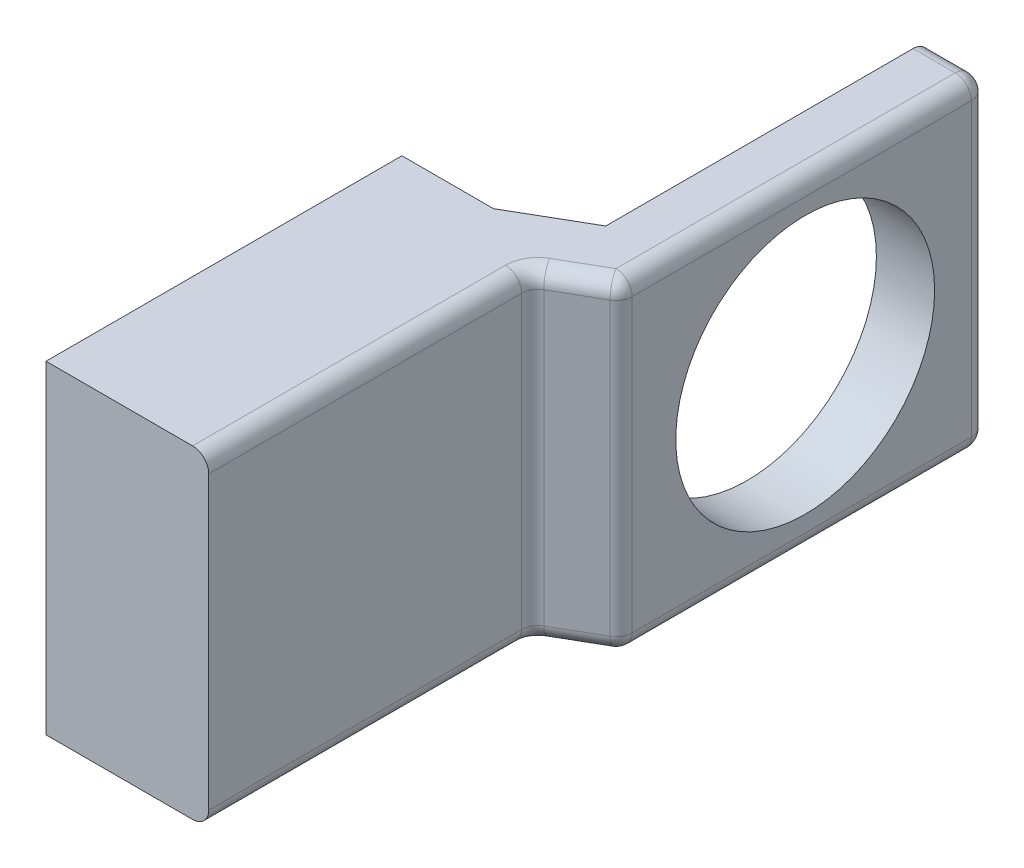
from build123d import *

# Parameters (mm, degrees)
BOSS_EXTRUDE1_DEPTH = 100
CUT_EXTRUDE1_REACH  = 167.428
SKETCH2_R           = 40
FILLET2_R           = 5


with BuildPart() as part:
    # Sketch1 → Boss-Extrude1 (new body)
    with BuildSketch(Plane(origin=(0, 0, 0), x_dir=(1, 0, 0), z_dir=(0, 1, 0))):
        Polygon((50.3, -110), (50.3, -10.392304845), (68.3, 0), (68.3, 112.701705922), (50.3, 112.701705922), (50.3, 12.701705922), (28.3, 0), (0, 0), (0, -110), align=None)
    extrude(amount=BOSS_EXTRUDE1_DEPTH)

    # Sketch2 → Cut-Extrude1 (cut, up to next)
    with BuildSketch(Plane(origin=(68.3, 0, 0), x_dir=(0, 0, -1), z_dir=(1, 0, 0)), mode=Mode.PRIVATE) as cut_extrude1_sk1:
        with Locations((56.350852961, 50)):
            Circle(SKETCH2_R)
    cut_extrude1_tool1 = extrude(cut_extrude1_sk1.sketch, amount=-CUT_EXTRUDE1_REACH, mode=Mode.PRIVATE) & part.part
    add(cut_extrude1_tool1.solids().sort_by_distance((68.3, 50, -56.350853))[0], mode=Mode.SUBTRACT)

    # Fillet2
    fillet2_edges = [part.edges().sort_by_distance(p)[0] for p in [
        (50.3, 0, 60.196152423),
        (50.3, 100, 60.196152423),
        (59.3, 0, 5.196152423),
        (59.3, 100, 5.196152423),
        (68.3, 0, -56.350852961),
        (68.3, 50, -112.701705922),
        (68.3, 100, -56.350852961),
        (68.3, 50, 0),
        (50.3, 50, 10.392304845),
        (59.3, 0, -112.701705922),
        (59.3, 100, -112.701705922),
    ]]
    fillet(fillet2_edges, radius=FILLET2_R)


solid = part.part
